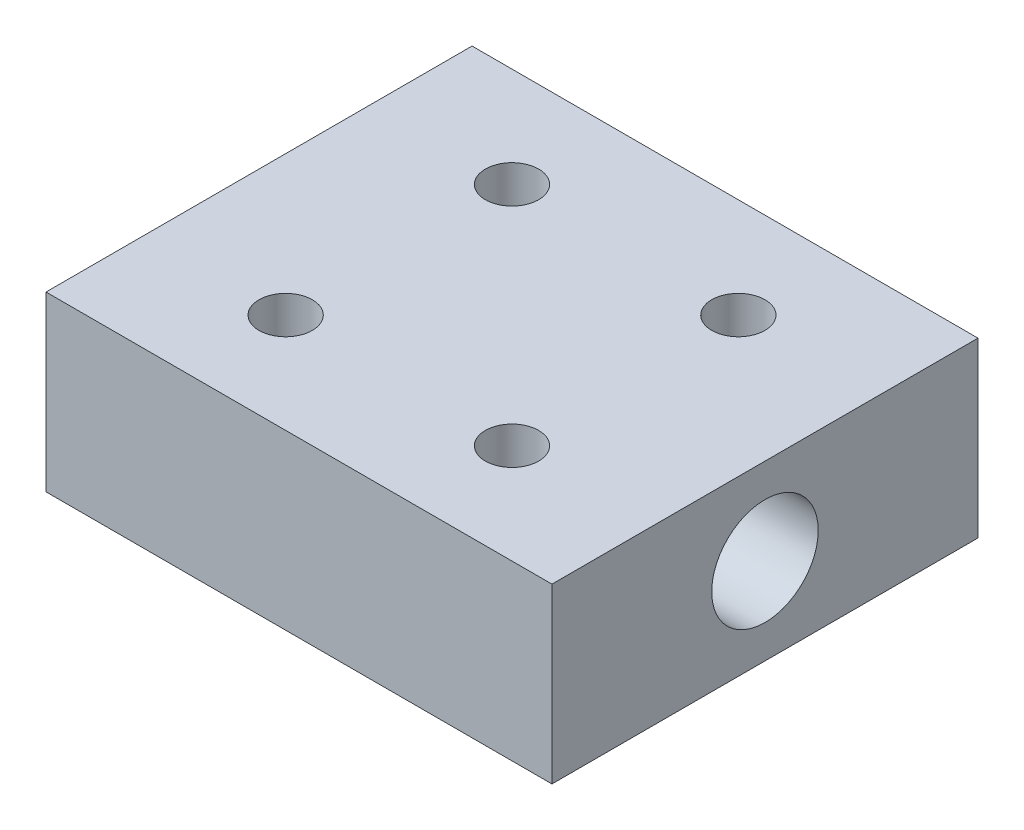
from build123d import *

# Parameters (mm, degrees)
SKETCH1_W           = 38
SKETCH1_H           = 32
BOSS_EXTRUDE1_DEPTH = 13
SKETCH2_R           = 2
CUT_EXTRUDE1_DEPTH  = 8
SKETCH3_R           = 4
CUT_EXTRUDE2_DEPTH  = 44.231932642


with BuildPart() as part:
    # Sketch1 → Boss-Extrude1 (new body)
    with BuildSketch(Plane(origin=(0, 0, 0), x_dir=(1, 0, 0), z_dir=(0, 1, 0))):
        Rectangle(SKETCH1_W, SKETCH1_H)
    extrude(amount=BOSS_EXTRUDE1_DEPTH)

    # Sketch2 → Cut-Extrude1 (cut)
    with BuildSketch(Plane(origin=(0, 13, 0), x_dir=(1, 0, 0), z_dir=(0, 1, 0))):
        with Locations(Location((8.5, 8.5, 0), (0, 0, 270))):
            Circle(SKETCH2_R)
        with Locations(Location((-8.5, 8.5, 0), (0, 0, 90))):
            Circle(SKETCH2_R)
        with Locations(Location((-8.5, -8.5, 0), (0, 0, 270))):
            Circle(SKETCH2_R)
        with Locations(Location((8.5, -8.5, 0), (0, 0, 90))):
            Circle(SKETCH2_R)
    extrude(amount=-CUT_EXTRUDE1_DEPTH, mode=Mode.SUBTRACT)

    # Sketch3 → Cut-Extrude2 (cut, through all)
    with BuildSketch(Plane(origin=(19, 0, 0), x_dir=(0, 0, -1), z_dir=(1, 0, 0))):
        with Locations((0, 6.5)):
            Circle(SKETCH3_R)
    extrude(amount=-CUT_EXTRUDE2_DEPTH, mode=Mode.SUBTRACT)


solid = part.part
